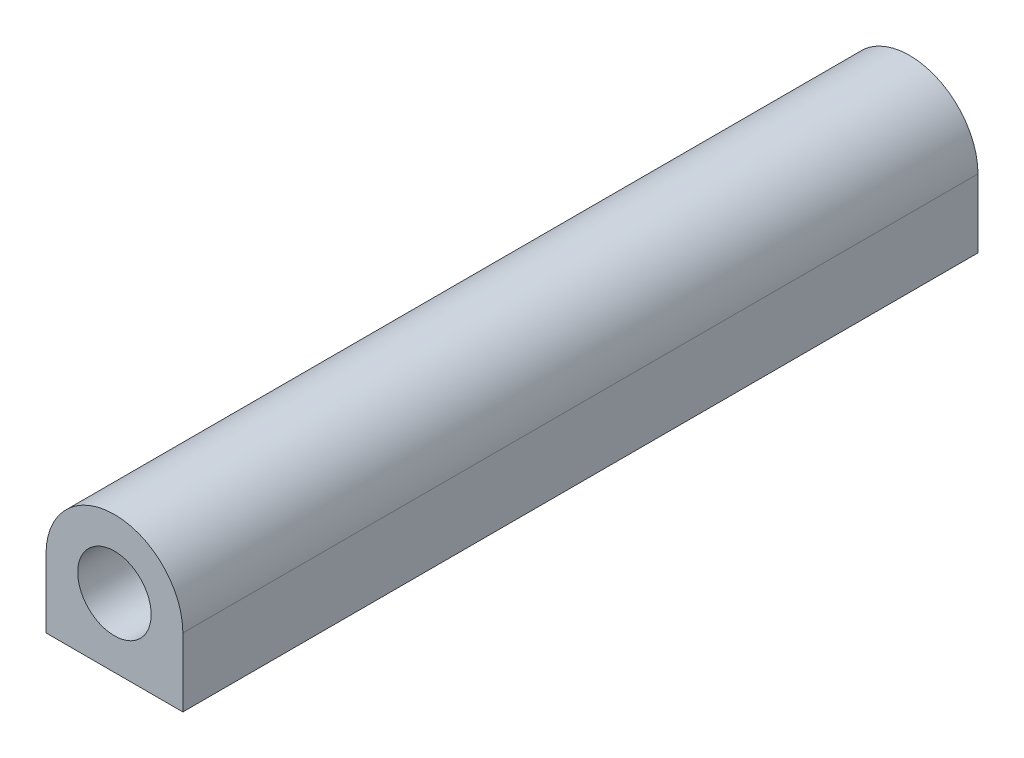
from build123d import *

# Parameters (mm, degrees)
SKETCH1_R           = 2.75
SKETCH1_R_2         = 1.475
BOSS_EXTRUDE1_DEPTH = 31.95
BOSS_EXTRUDE2_START = -31.95
BOSS_EXTRUDE2_DEPTH = 31.95
SKETCH3_R           = 1.475
BOSS_EXTRUDE3_DEPTH = 31.95
SKETCH4_R           = 1.475
CUT_EXTRUDE1_DEPTH  = 10
CUT_EXTRUDE2_START  = -10
SKETCH5_R           = 1.475
CUT_EXTRUDE2_DEPTH  = 10


with BuildPart() as part:
    # Sketch1 → Boss-Extrude1 (new body)
    with BuildSketch(Plane.XY):
        Circle(SKETCH1_R)
        Circle(SKETCH1_R_2, mode=Mode.SUBTRACT)
    extrude(amount=BOSS_EXTRUDE1_DEPTH)

    # Sketch2 → Boss-Extrude2 (add)
    with BuildSketch(Plane.XY.offset(31.95).offset(BOSS_EXTRUDE2_START)):
        with BuildLine():
            ThreePointArc((0, -2.75), (-1.944543648, -1.944543648), (-2.75, 0))
            Line((-2.75, 0), (-2.75, -2.75))
            Line((-2.75, -2.75), (0, -2.75))
        make_face()
        with BuildLine():
            Line((2.75, -2.75), (2.75, 0))
            ThreePointArc((2.75, 0), (1.944543648, -1.944543648), (0, -2.75))
            Line((0, -2.75), (2.75, -2.75))
        make_face()
    extrude(amount=BOSS_EXTRUDE2_DEPTH)

    # Sketch3 → Boss-Extrude3 (add)
    with BuildSketch(Plane(origin=(0, 0, 0), x_dir=(-1, 0, 0), z_dir=(0, 0, -1))):
        Circle(SKETCH3_R)
    extrude(amount=-BOSS_EXTRUDE3_DEPTH)

    # Sketch4 → Cut-Extrude1 (cut)
    with BuildSketch(Plane(origin=(0, 0, 0), x_dir=(-1, 0, 0), z_dir=(0, 0, -1))):
        Circle(SKETCH4_R)
    extrude(amount=-CUT_EXTRUDE1_DEPTH, mode=Mode.SUBTRACT)

    # Sketch5 → Cut-Extrude2 (cut)
    with BuildSketch(Plane.XY.offset(31.95).offset(CUT_EXTRUDE2_START)):
        with Locations(Location((0, 0, 0), (0, 0, 180))):
            Circle(SKETCH5_R)
    extrude(amount=CUT_EXTRUDE2_DEPTH, mode=Mode.SUBTRACT)


solid = part.part
